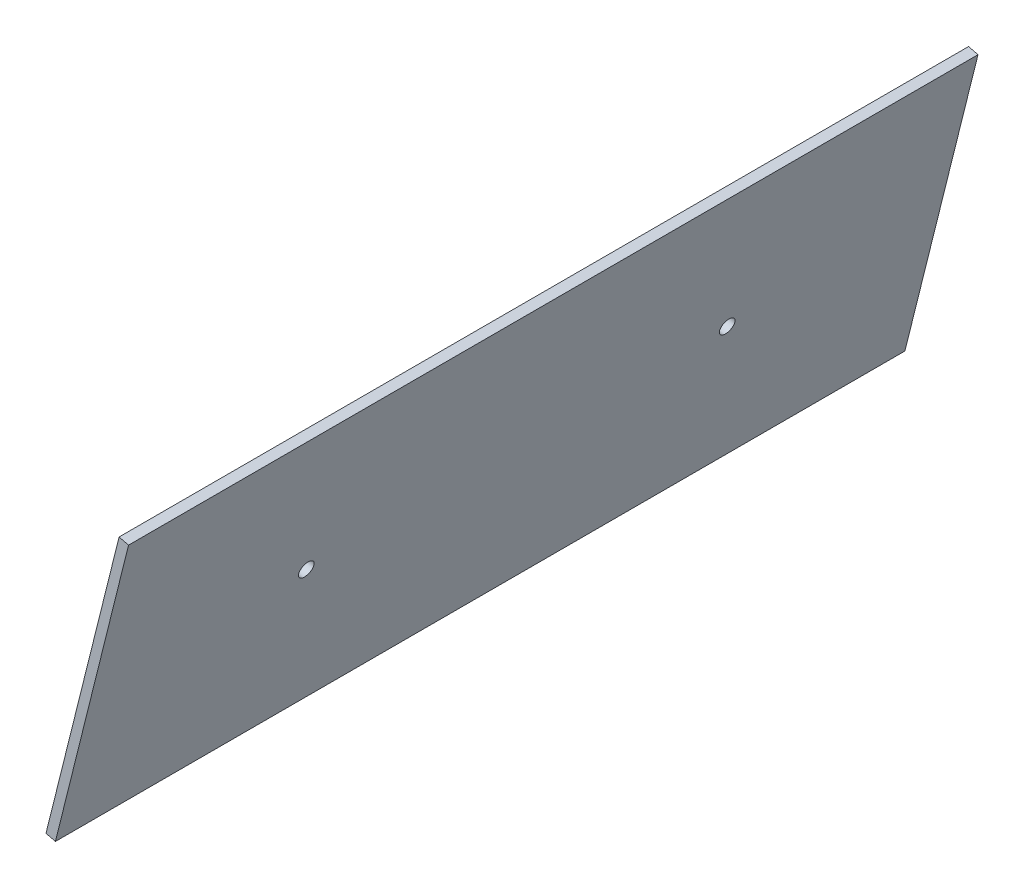
from build123d import *

# Parameters (mm, degrees)
BOSS_EXTRUDE1_DEPTH = 277.475
CUT_EXTRUDE1_REACH  = 284.517
SKETCH2_R           = 2.5


with BuildPart() as part:
    # Sketch1 → Boss-Extrude1 (new body)
    with BuildSketch(Plane.XY):
        Polygon((-37.629508919, -38.824877845), (-13.751817824, 56.943310339), (-16.832506755, 57.711412357), (-40.71019785, -38.056775826), align=None)
    extrude(amount=BOSS_EXTRUDE1_DEPTH)

    # Sketch2 → Cut-Extrude1 (cut, up to next)
    with BuildSketch(Plane(origin=(-26.313608582, 6.560719475, 0), x_dir=(0, 0, -1), z_dir=(0.9702957262759973, -0.24192189559966462, 0)), mode=Mode.PRIVATE) as cut_extrude1_sk1:
        with Locations(Location((-207.475, 2.616835031, 0), (0, 0, 90))):
            Circle(SKETCH2_R)
    cut_extrude1_tool1 = extrude(cut_extrude1_sk1.sketch, amount=-CUT_EXTRUDE1_REACH, mode=Mode.PRIVATE) & part.part
    # Sketch2 → Cut-Extrude1 (cut, up to next)
    with BuildSketch(Plane(origin=(-26.313608582, 6.560719475, 0), x_dir=(0, 0, -1), z_dir=(0.9702957262759973, -0.24192189559966462, 0)), mode=Mode.PRIVATE) as cut_extrude1_sk2:
        with Locations(Location((-70, 2.616835031, 0), (0, 0, 90))):
            Circle(SKETCH2_R)
    cut_extrude1_tool2 = extrude(cut_extrude1_sk2.sketch, amount=-CUT_EXTRUDE1_REACH, mode=Mode.PRIVATE) & part.part
    add(cut_extrude1_tool1.solids().sort_by_distance((-25.680539, 9.099823, 207.475))[0], mode=Mode.SUBTRACT)
    add(cut_extrude1_tool2.solids().sort_by_distance((-25.680539, 9.099823, 70))[0], mode=Mode.SUBTRACT)


solid = part.part
